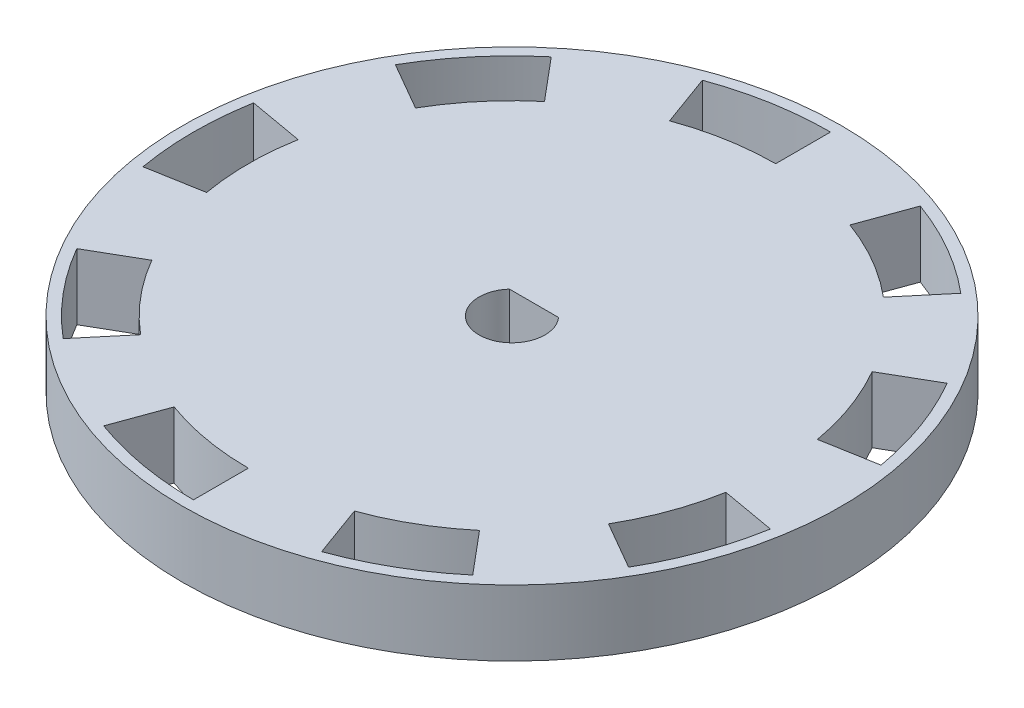
from build123d import *

# Parameters (mm, degrees)
SKETCH1_R           = 15
BOSS_EXTRUDE1_DEPTH = 3


with BuildPart() as part:
    # Sketch1 → Boss-Extrude1 (new body)
    with BuildSketch(Plane(origin=(0, 0, 0), x_dir=(1, 0, 0), z_dir=(0, 1, 0))):
        with Locations(Location((0, 0, 0), (0, 0, 270))):
            Circle(SKETCH1_R)
        with BuildLine():
            Line((-1.118033989, 1), (1.118033989, 1))
            ThreePointArc((1.118033989, 1), (0, -1.5), (-1.118033989, 1))
        make_face(mode=Mode.SUBTRACT)
        with BuildLine():
            Line((-12.557368355, -7.25), (-10.392304845, -6))
            ThreePointArc((-10.392304845, -6), (-9.192533317, -7.713451316), (-7.713451316, -9.192533317))
            Line((-7.713451316, -9.192533317), (-9.32042034, -11.107644425))
            ThreePointArc((-9.32042034, -11.107644425), (-11.107644425, -9.32042034), (-12.557368355, -7.25))
        make_face(mode=Mode.SUBTRACT)
        with BuildLine():
            Line((-4.959292078, -13.625543001), (-4.10424172, -11.276311449))
            ThreePointArc((-4.10424172, -11.276311449), (-2.083778132, -11.817693036), (0, -12))
            Line((0, -12), (0, -14.5))
            ThreePointArc((0, -14.5), (-2.517898576, -14.279712419), (-4.959292078, -13.625543001))
        make_face(mode=Mode.SUBTRACT)
        with BuildLine():
            Line((4.959292078, -13.625543001), (4.10424172, -11.276311449))
            ThreePointArc((4.10424172, -11.276311449), (6, -10.392304845), (7.713451316, -9.192533317))
            Line((7.713451316, -9.192533317), (9.32042034, -11.107644425))
            ThreePointArc((9.32042034, -11.107644425), (7.25, -12.557368355), (4.959292078, -13.625543001))
        make_face(mode=Mode.SUBTRACT)
        with BuildLine():
            Line((12.557368355, -7.25), (10.392304845, -6))
            ThreePointArc((10.392304845, -6), (11.276311449, -4.10424172), (11.817693036, -2.083778132))
            Line((11.817693036, -2.083778132), (14.279712419, -2.517898576))
            ThreePointArc((14.279712419, -2.517898576), (13.625543001, -4.959292078), (12.557368355, -7.25))
        make_face(mode=Mode.SUBTRACT)
        with BuildLine():
            Line((-14.279712419, 2.517898576), (-11.817693036, 2.083778132))
            ThreePointArc((-11.817693036, 2.083778132), (-12, 0), (-11.817693036, -2.083778132))
            Line((-11.817693036, -2.083778132), (-14.279712419, -2.517898576))
            ThreePointArc((-14.279712419, -2.517898576), (-14.5, 0), (-14.279712419, 2.517898576))
        make_face(mode=Mode.SUBTRACT)
        with BuildLine():
            Line((-9.32042034, 11.107644425), (-7.713451316, 9.192533317))
            ThreePointArc((-7.713451316, 9.192533317), (-9.192533317, 7.713451316), (-10.392304845, 6))
            Line((-10.392304845, 6), (-12.557368355, 7.25))
            ThreePointArc((-12.557368355, 7.25), (-11.107644425, 9.32042034), (-9.32042034, 11.107644425))
        make_face(mode=Mode.SUBTRACT)
        with BuildLine():
            Line((-4.10424172, 11.276311449), (-4.959292078, 13.625543001))
            ThreePointArc((-4.959292078, 13.625543001), (-2.517898576, 14.279712419), (0, 14.5))
            Line((0, 14.5), (0, 12))
            ThreePointArc((0, 12), (-2.083778132, 11.817693036), (-4.10424172, 11.276311449))
        make_face(mode=Mode.SUBTRACT)
        with BuildLine():
            ThreePointArc((11.817693036, 2.083778132), (11.276311449, 4.10424172), (10.392304845, 6))
            Line((10.392304845, 6), (12.557368355, 7.25))
            ThreePointArc((12.557368355, 7.25), (13.625543001, 4.959292078), (14.279712419, 2.517898576))
            Line((14.279712419, 2.517898576), (11.817693036, 2.083778132))
        make_face(mode=Mode.SUBTRACT)
        with BuildLine():
            Line((9.32042034, 11.107644425), (7.713451316, 9.192533317))
            ThreePointArc((7.713451316, 9.192533317), (6, 10.392304845), (4.10424172, 11.276311449))
            Line((4.10424172, 11.276311449), (4.959292078, 13.625543001))
            ThreePointArc((4.959292078, 13.625543001), (7.25, 12.557368355), (9.32042034, 11.107644425))
        make_face(mode=Mode.SUBTRACT)
    extrude(amount=BOSS_EXTRUDE1_DEPTH)


solid = part.part
